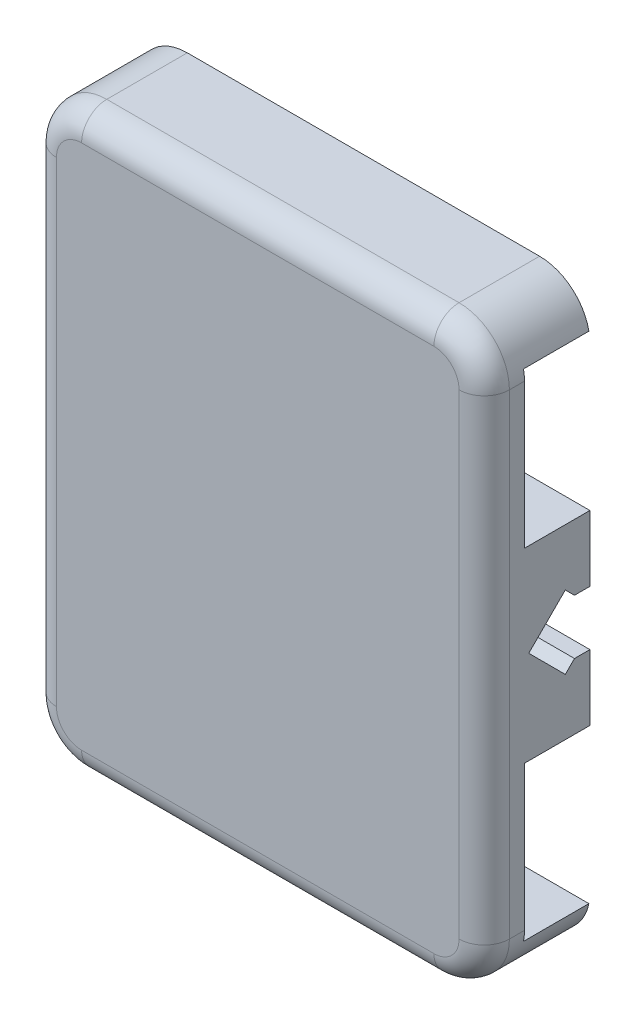
from build123d import *

# Parameters (mm, degrees)
SKETCH1_W               = 3.3
SKETCH1_H               = 7.4
BOSS_EXTRUDE1_DEPTH     = 2.6
BOSS_EXTRUDE1_2_DEPTH   = 2.6
BOSS_EXTRUDE1_3_DEPTH   = 2.6
SKETCH1_W_2             = 18
SKETCH1_H_2             = 1.6
BOSS_EXTRUDE1_4_DEPTH   = 2.6
BOSS_EXTRUDE1_5_DEPTH   = 2.6
SKETCH3_W               = 18
SKETCH3_H               = 22.9
BOSS_EXTRUDE2_DEPTH     = 1.6
CUT_EXTRUDE1_DEPTH      = 27.511924597
CUT_EXTRUDE1_DEPTH_BACK = 27.511924597
FILLET1_R               = 2
FILLET2_R               = 1


with BuildPart() as part:
    # Sketch1 → Boss-Extrude1 (new body)
    with BuildSketch(Plane.XY):
        with Locations((-6.907290918, -7.556371191)):
            Rectangle(SKETCH1_W, SKETCH1_H)
    extrude(amount=BOSS_EXTRUDE1_DEPTH)



with BuildPart() as body_2:
    # Sketch1 → Boss-Extrude1 2 (new body)
    with BuildSketch(Plane.XY):
        with Locations((0.442709082, -7.556371191)):
            Rectangle(SKETCH1_W, SKETCH1_H)
    extrude(amount=BOSS_EXTRUDE1_2_DEPTH)


with BuildPart() as body_3:
    # Sketch1 → Boss-Extrude1 3 (new body)
    with BuildSketch(Plane.XY):
        with Locations((7.792709082, -7.556371191)):
            Rectangle(SKETCH1_W, SKETCH1_H)
    extrude(amount=BOSS_EXTRUDE1_3_DEPTH)


with BuildPart() as body_4:
    # Sketch1 → Boss-Extrude1 4 (new body)
    with BuildSketch(Plane.XY):
        with Locations((0.442709082, 3.093628809)):
            Rectangle(SKETCH1_W_2, SKETCH1_H_2)
    extrude(amount=BOSS_EXTRUDE1_4_DEPTH)


with BuildPart() as body_5:
    # Sketch1 → Boss-Extrude1 5 (new body)
    with BuildSketch(Plane.XY):
        with Locations((0.442709082, -18.206371191)):
            Rectangle(SKETCH1_W_2, SKETCH1_H_2)
    extrude(amount=BOSS_EXTRUDE1_5_DEPTH)


with BuildPart() as part_1:
    add(part.part)

    add(body_2.part)  # Boss-Extrude2 merges body 2

    add(body_3.part)  # Boss-Extrude2 merges body 3

    add(body_4.part)  # Boss-Extrude2 merges body 4

    add(body_5.part)  # Boss-Extrude2 merges body 5
    # Sketch3 → Boss-Extrude2 (add)
    with BuildSketch(Plane.XY.offset(2.6)):
        with Locations((0.442709082, -7.556371191)):
            Rectangle(SKETCH3_W, SKETCH3_H)
    extrude(amount=BOSS_EXTRUDE2_DEPTH)

    # Sketch4 → Cut-Extrude1 (cut, two sides: drawn at the far end of the back side and taken through both)
    with BuildSketch(Plane.ZY.offset(8.557290918).offset(-CUT_EXTRUDE1_DEPTH_BACK)):
        Polygon((1.342435563, -8.644254243), (0.613371363, -8.644254243), (0.977903463, -9.008786343), align=None)
        Polygon((2.430318615, -7.556371191), (1.342435563, -6.468488139), (1.342435563, -8.644254243), align=None)
        Polygon((0.977903463, -6.103956039), (0.613371363, -6.468488139), (1.342435563, -6.468488139), align=None)
        Polygon((0.613371363, -6.468488139), (0, -7.081859502), (0, -8.03088288), (0.613371363, -8.644254243), (1.342435563, -8.644254243), (1.342435563, -6.468488139), align=None)
        Polygon((0, -6.468488139), (0, -7.081859502), (0.613371363, -6.468488139), align=None)
        Polygon((0.613371363, -8.644254243), (0, -8.03088288), (0, -8.644254243), align=None)
    extrude(amount=CUT_EXTRUDE1_DEPTH + CUT_EXTRUDE1_DEPTH_BACK, mode=Mode.SUBTRACT)

    # Fillet1
    fillet1_edges = [part_1.edges().sort_by_distance(p)[0] for p in [
        (-8.557290918, 3.893628809, 2.1),
        (9.442709082, 3.893628809, 2.1),
        (9.442709082, -19.006371191, 2.1),
        (-8.557290918, -19.006371191, 2.1),
    ]]
    fillet(fillet1_edges, radius=FILLET1_R)

    # Fillet2
    fillet2_edges = [part_1.edges().sort_by_distance(p)[0] for p in [
        (-8.557290918, -7.556371191, 4.2),
        (0.442709082, 3.893628809, 4.2),
        (0.442709082, -19.006371191, 4.2),
        (9.442709082, -7.556371191, 4.2),
        (-7.97150448, -18.420584754, 4.2),
        (8.856922645, -18.420584754, 4.2),
        (8.856922645, 3.307842371, 4.2),
        (-7.97150448, 3.307842371, 4.2),
    ]]
    fillet(fillet2_edges, radius=FILLET2_R)


solid = part_1.part
